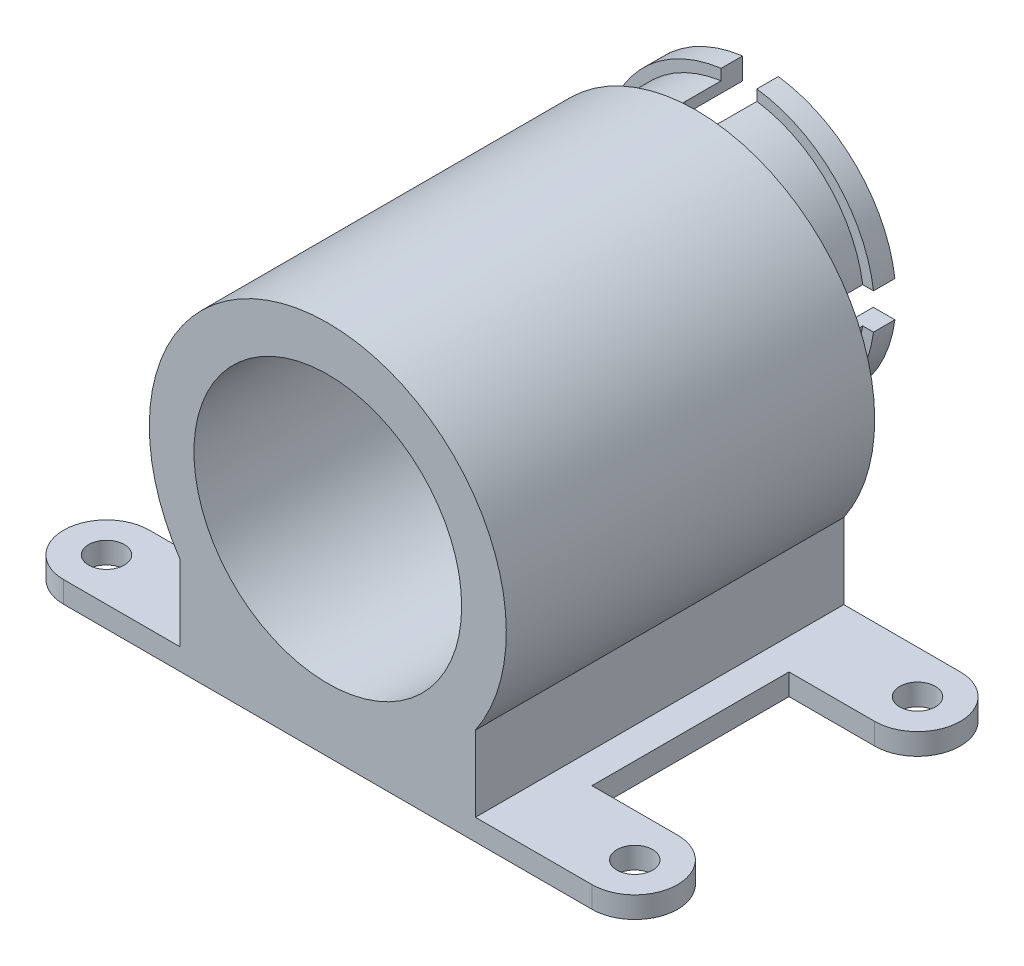
from build123d import *

# Parameters (mm, degrees)
CROQUIS1_R                 = 21.1
SALIENTE_EXTRUIR1_DEPTH    = 51.6
CROQUIS2_R                 = 18.75
CORTAR_EXTRUIR1_DEPTH      = 48.6
CROQUIS5_R                 = 7.775
CROQUIS5_R_2               = 6.275
SALIENTE_EXTRUIR3_DEPTH    = 6
CORTAR_EXTRUIR2_START      = -66
CROQUIS6_R                 = 6.275
CORTAR_EXTRUIR2_DEPTH      = 66
CROQUIS10_R                = 25
CROQUIS10_R_2              = 21.1
SALIENTE_EXTRUIR4_DEPTH    = 51.6
CROQUIS11_R                = 17.5
CROQUIS11_R_2              = 16
SALIENTE_EXTRUIR5_DEPTH    = 9
SALIENTE_EXTRUIR6_START    = -3
CROQUIS12_R                = 19
CROQUIS12_R_2              = 17.5
SALIENTE_EXTRUIR6_DEPTH    = 3
SALIENTE_EXTRUIR7_DEPTH    = 51.6
SALIENTE_EXTRUIR8_REACH    = 78.981
CROQUIS14_W                = 51.6
CROQUIS14_H                = 3
CROQUIS16_W                = 12
CROQUIS16_H                = 3
SALIENTE_EXTRUIR9_DEPTH    = 12
SALIENTE_EXTRUIR11_DEPTH   = 3
CROQUIS19_R                = 2.5
CORTAR_EXTRUIR5_DEPTH      = 15
CROQUIS20_W                = 12
CROQUIS20_H                = 3
SALIENTE_EXTRUIR12_DEPTH   = 12
SALIENTE_EXTRUIR13_DEPTH   = 3
CROQUIS22_R                = 2.5
CORTAR_EXTRUIR6_DEPTH      = 12
SALIENTE_EXTRUIR14_DEPTH   = 8
SALIENTE_EXTRUIR14_2_DEPTH = 8
CROQUIS26_W                = 2.5
CROQUIS26_H                = 8
CORTAR_EXTRUIR11_DEPTH     = 10
CROQUIS27_W                = 8
CROQUIS27_H                = 2.5
CORTAR_EXTRUIR12_DEPTH     = 13


with BuildPart() as part:
    # Croquis1 → Saliente-Extruir1 (new body)
    with BuildSketch(Plane.XY):
        with Locations(Location((0, 0, 0), (0, 0, 180))):
            Circle(CROQUIS1_R)
    extrude(amount=SALIENTE_EXTRUIR1_DEPTH)

    # Croquis2 → Cortar-Extruir1 (cut)
    with BuildSketch(Plane.XY.offset(51.6)):
        Circle(CROQUIS2_R)
    extrude(amount=-CORTAR_EXTRUIR1_DEPTH, mode=Mode.SUBTRACT)

    # Croquis5 → Saliente-Extruir3 (add)
    with BuildSketch(Plane.XY.offset(3)):
        with Locations((0, 7)):
            Circle(CROQUIS5_R)
        with Locations((0, 7)):
            Circle(CROQUIS5_R_2, mode=Mode.SUBTRACT)
    extrude(amount=-SALIENTE_EXTRUIR3_DEPTH)

    # Croquis6 → Cortar-Extruir2 (cut)
    with BuildSketch(Plane(origin=(0, 0, 0), x_dir=(-1, 0, 0), z_dir=(0, 0, -1)).offset(CORTAR_EXTRUIR2_START)):
        with Locations(Location((0, 7, 0), (0, 0, 180))):
            Circle(CROQUIS6_R)
    extrude(amount=CORTAR_EXTRUIR2_DEPTH, mode=Mode.SUBTRACT)

    # Croquis10 → Saliente-Extruir4 (add)
    with BuildSketch(Plane(origin=(0, 0, 0), x_dir=(-1, 0, 0), z_dir=(0, 0, -1))):
        Circle(CROQUIS10_R)
        Circle(CROQUIS10_R_2, mode=Mode.SUBTRACT)
    extrude(amount=-SALIENTE_EXTRUIR4_DEPTH)

    # Croquis11 → Saliente-Extruir5 (add)
    with BuildSketch(Plane(origin=(0, 0, 0), x_dir=(-1, 0, 0), z_dir=(0, 0, -1))):
        with Locations(Location((0, 7, 0), (0, 0, 180))):
            Circle(CROQUIS11_R)
        with Locations((0, 7)):
            Circle(CROQUIS11_R_2, mode=Mode.SUBTRACT)
    extrude(amount=SALIENTE_EXTRUIR5_DEPTH)

    # Croquis12 → Saliente-Extruir6 (add)
    with BuildSketch(Plane(origin=(0, 0, -9), x_dir=(-1, 0, 0), z_dir=(0, 0, -1)).offset(SALIENTE_EXTRUIR6_START)):
        with Locations((0, 7)):
            Circle(CROQUIS12_R)
        with Locations(Location((0, 7, 0), (0, 0, 180))):
            Circle(CROQUIS12_R_2, mode=Mode.SUBTRACT)
    extrude(amount=SALIENTE_EXTRUIR6_DEPTH)

    # Croquis13 → Saliente-Extruir7 (add)
    with BuildSketch(Plane(origin=(0, 0, 0), x_dir=(-1, 0, 0), z_dir=(0, 0, -1))):
        with BuildLine():
            Line((-20.673776338, -25), (0, -25))
            ThreePointArc((0, -25), (-11.695700136, -22.095488189), (-20.673776338, -14.056847866))
            Line((-20.673776338, -14.056847866), (-20.673776338, -25))
        make_face()
        with BuildLine():
            ThreePointArc((20.673776338, -14.056847866), (11.695700136, -22.095488189), (0, -25))
            Line((0, -25), (20.673776338, -25))
            Line((20.673776338, -25), (20.673776338, -14.056847866))
        make_face()
        Polygon((25, -27.632757418), (25, -25), (0, -25), (-25, -25), (-25, -27.632757418), align=None)
    extrude(amount=-SALIENTE_EXTRUIR7_DEPTH)

    # Saliente-Extruir8: up to this face of the body (flat: up to its plane)
    saliente_extruir8_end = Plane(part.part.faces().sort_by_distance((-25, -26.316378709, 25.8))[0])
    # Croquis14 → Saliente-Extruir8 (add, up to the picked face)
    with BuildSketch(Plane(origin=(25, 0, 0), x_dir=(0, 0, -1), z_dir=(1, 0, 0)), mode=Mode.PRIVATE) as saliente_extruir8_sk1:
        with Locations((-25.8, -26.132757418)):
            Rectangle(CROQUIS14_W, CROQUIS14_H)
    saliente_extruir8_tool1 = split(extrude(saliente_extruir8_sk1.sketch, amount=-SALIENTE_EXTRUIR8_REACH, mode=Mode.PRIVATE), bisect_by=saliente_extruir8_end, keep=Keep.BOTH, mode=Mode.PRIVATE)
    add(saliente_extruir8_tool1.solids().sort_by(Axis((25, -26.132757, 25.8), (-1, 0, 0)))[0])

    # Croquis16 → Saliente-Extruir9 (add)
    with BuildSketch(Plane(origin=(25, 0, 0), x_dir=(0, 0, -1), z_dir=(1, 0, 0))):
        with Locations((-45.6, -26.132757418)):
            Rectangle(CROQUIS16_W, CROQUIS16_H)
        with Locations((-6, -26.132757418)):
            Rectangle(CROQUIS16_W, CROQUIS16_H)
    extrude(amount=SALIENTE_EXTRUIR9_DEPTH)

    # Croquis18 → Saliente-Extruir11 (add)
    with BuildSketch(Plane(origin=(0, -24.632757418, 0), x_dir=(1, 0, 0), z_dir=(0, 1, 0))):
        with BuildLine():
            ThreePointArc((37, -12), (41.242640687, -10.242640687), (43, -6))
            ThreePointArc((43, -6), (41.242640687, -1.757359313), (37, 0))
            Line((37, 0), (37, -12))
        make_face()
        with BuildLine():
            Line((37, -12), (37, 0))
            ThreePointArc((37, 0), (31, -6), (37, -12))
        make_face()
        with BuildLine():
            ThreePointArc((43, -45.6), (41.242640687, -41.357359313), (37, -39.6))
            Line((37, -39.6), (37, -51.6))
            ThreePointArc((37, -51.6), (41.242640687, -49.842640687), (43, -45.6))
        make_face()
        with BuildLine():
            Line((37, -51.6), (37, -39.6))
            ThreePointArc((37, -39.6), (31, -45.6), (37, -51.6))
        make_face()
    extrude(amount=-SALIENTE_EXTRUIR11_DEPTH)

    # Croquis19 → Cortar-Extruir5 (cut)
    with BuildSketch(Plane(origin=(0, -24.632757418, 0), x_dir=(1, 0, 0), z_dir=(0, 1, 0))):
        with Locations(Location((37, -6, 0), (0, 0, 270))):
            Circle(CROQUIS19_R)
        with Locations(Location((37, -45.6, 0), (0, 0, 270))):
            Circle(CROQUIS19_R)
    extrude(amount=-CORTAR_EXTRUIR5_DEPTH, mode=Mode.SUBTRACT)

    # Croquis20 → Saliente-Extruir12 (add)
    with BuildSketch(Plane.ZY.offset(25)):
        with Locations((6, -26.132757418)):
            Rectangle(CROQUIS20_W, CROQUIS20_H)
        with Locations((45.6, -26.132757418)):
            Rectangle(CROQUIS20_W, CROQUIS20_H)
    extrude(amount=SALIENTE_EXTRUIR12_DEPTH)

    # Croquis21 → Saliente-Extruir13 (add)
    with BuildSketch(Plane(origin=(0, -24.632757418, 0), x_dir=(1, 0, 0), z_dir=(0, 1, 0))):
        with BuildLine():
            ThreePointArc((-31, -6), (-32.757359313, -1.757359313), (-37, 0))
            Line((-37, 0), (-37, -12))
            ThreePointArc((-37, -12), (-32.757359313, -10.242640687), (-31, -6))
        make_face()
        with BuildLine():
            Line((-37, -12), (-37, 0))
            ThreePointArc((-37, 0), (-43, -6), (-37, -12))
        make_face()
        with BuildLine():
            ThreePointArc((-31, -45.6), (-32.757359313, -41.357359313), (-37, -39.6))
            Line((-37, -39.6), (-37, -51.6))
            ThreePointArc((-37, -51.6), (-32.757359313, -49.842640687), (-31, -45.6))
        make_face()
        with BuildLine():
            Line((-37, -51.6), (-37, -39.6))
            ThreePointArc((-37, -39.6), (-43, -45.6), (-37, -51.6))
        make_face()
    extrude(amount=-SALIENTE_EXTRUIR13_DEPTH)

    # Croquis22 → Cortar-Extruir6 (cut)
    with BuildSketch(Plane(origin=(0, -24.632757418, 0), x_dir=(1, 0, 0), z_dir=(0, 1, 0))):
        with Locations(Location((-37, -6, 0), (0, 0, 270))):
            Circle(CROQUIS22_R)
        with Locations(Location((-37, -45.6, 0), (0, 0, 270))):
            Circle(CROQUIS22_R)
    extrude(amount=-CORTAR_EXTRUIR6_DEPTH, mode=Mode.SUBTRACT)


with BuildPart() as body_2:
    # Croquis23 → Saliente-Extruir14 (new body)
    with BuildSketch(Plane(origin=(0, 0, -9), x_dir=(-1, 0, 0), z_dir=(0, 0, -1))):
        Polygon((2.5, 29.282754404), (2.5, 26), (0, 26), (-2.5, 26), (-2.5, 29.282754404), align=None)
    extrude(amount=-SALIENTE_EXTRUIR14_DEPTH)


with BuildPart() as body_3:
    # Croquis23 → Saliente-Extruir14 2 (new body)
    with BuildSketch(Plane(origin=(0, 0, -9), x_dir=(-1, 0, 0), z_dir=(0, 0, -1))):
        Polygon((-23.376501852, 9.5), (-23.376501852, 4.5), (-19, 4.5), (-19, 7), (-19, 9.5), align=None)
    extrude(amount=-SALIENTE_EXTRUIR14_2_DEPTH)


with BuildPart() as cortar_extruir11_tool:
    # Croquis26 → Cortar-Extruir11 (new body)
    with BuildSketch(Plane(origin=(0, 29.282754404, 0), x_dir=(1, 0, 0), z_dir=(0, 1, 0))):
        with BuildLine():
            ThreePointArc((2.5, 9), (0, 11.5), (-2.5, 9))
            Line((-2.5, 9), (2.5, 9))
        make_face()
        with Locations((-1.25, 5)):
            Rectangle(CROQUIS26_W, CROQUIS26_H)
        with Locations((1.25, 5)):
            Rectangle(CROQUIS26_W, CROQUIS26_H)
        with BuildLine():
            Line((2.5, 1), (0, 1))
            Line((0, 1), (-2.5, 1))
            ThreePointArc((-2.5, 1), (-2.447265782, 0.489225891), (-2.291287847, 0))
            Line((-2.291287847, 0), (2.291287847, 0))
            ThreePointArc((2.291287847, 0), (2.447265782, 0.489225891), (2.5, 1))
        make_face()
    extrude(amount=-CORTAR_EXTRUIR11_DEPTH)


with BuildPart() as part_1:
    add(part.part)

    # Cortar-Extruir11: cut by cortar_extruir11_tool
    add(cortar_extruir11_tool.part, mode=Mode.SUBTRACT)


with BuildPart() as body_2_1:
    add(body_2.part)

    # Cortar-Extruir11: cut by cortar_extruir11_tool
    add(cortar_extruir11_tool.part, mode=Mode.SUBTRACT)


with BuildPart() as cortar_extruir12_tool:
    # Croquis27 → Cortar-Extruir12 (new body)
    with BuildSketch(Plane(origin=(23.376501852, 0, 0), x_dir=(0, 0, -1), z_dir=(1, 0, 0))):
        with BuildLine():
            Line((1, 4.5), (1, 7))
            Line((1, 7), (1, 9.5))
            ThreePointArc((1, 9.5), (0.489225891, 9.447265782), (0, 9.291287847))
            Line((0, 9.291287847), (0, 4.708712153))
            ThreePointArc((0, 4.708712153), (0.489225891, 4.552734218), (1, 4.5))
        make_face()
        with Locations((5, 8.25)):
            Rectangle(CROQUIS27_W, CROQUIS27_H)
        with Locations((5, 5.75)):
            Rectangle(CROQUIS27_W, CROQUIS27_H)
        with BuildLine():
            ThreePointArc((9, 4.5), (11.5, 7), (9, 9.5))
            Line((9, 9.5), (9, 4.5))
        make_face()
    extrude(amount=-CORTAR_EXTRUIR12_DEPTH)


with BuildPart() as part_2:
    add(part_1.part)

    # Cortar-Extruir12: cut by cortar_extruir12_tool
    add(cortar_extruir12_tool.part, mode=Mode.SUBTRACT)


with BuildPart() as body_3_1:
    add(body_3.part)

    # Cortar-Extruir12: cut by cortar_extruir12_tool
    add(cortar_extruir12_tool.part, mode=Mode.SUBTRACT)


solid = part_2.part
